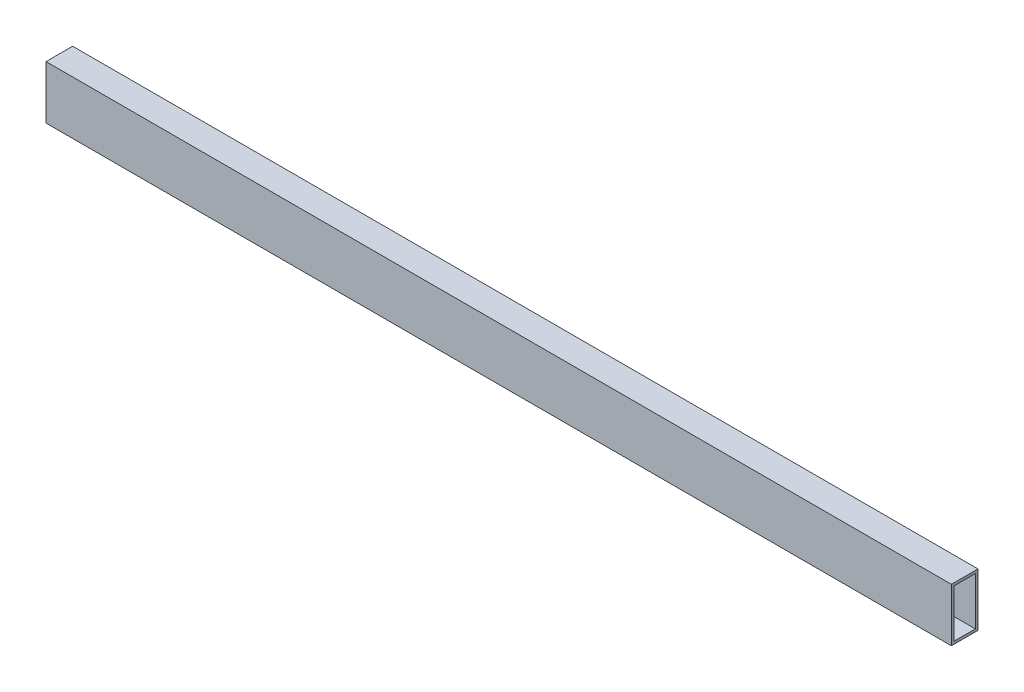
from build123d import *

# Parameters (mm, degrees)
SKETCH1_W           = 50
SKETCH1_H           = 100
SKETCH1_W_2         = 40
SKETCH1_H_2         = 90
BOSS_EXTRUDE1_DEPTH = 1700


with BuildPart() as part:
    # Sketch1 → Boss-Extrude1 (new body)
    with BuildSketch(Plane(origin=(0, 0, 0), x_dir=(0, 0, -1), z_dir=(1, 0, 0))):
        with Locations((25, 50)):
            Rectangle(SKETCH1_W, SKETCH1_H)
        with Locations((25, 50)):
            Rectangle(SKETCH1_W_2, SKETCH1_H_2, mode=Mode.SUBTRACT)
    extrude(amount=BOSS_EXTRUDE1_DEPTH)


solid = part.part
